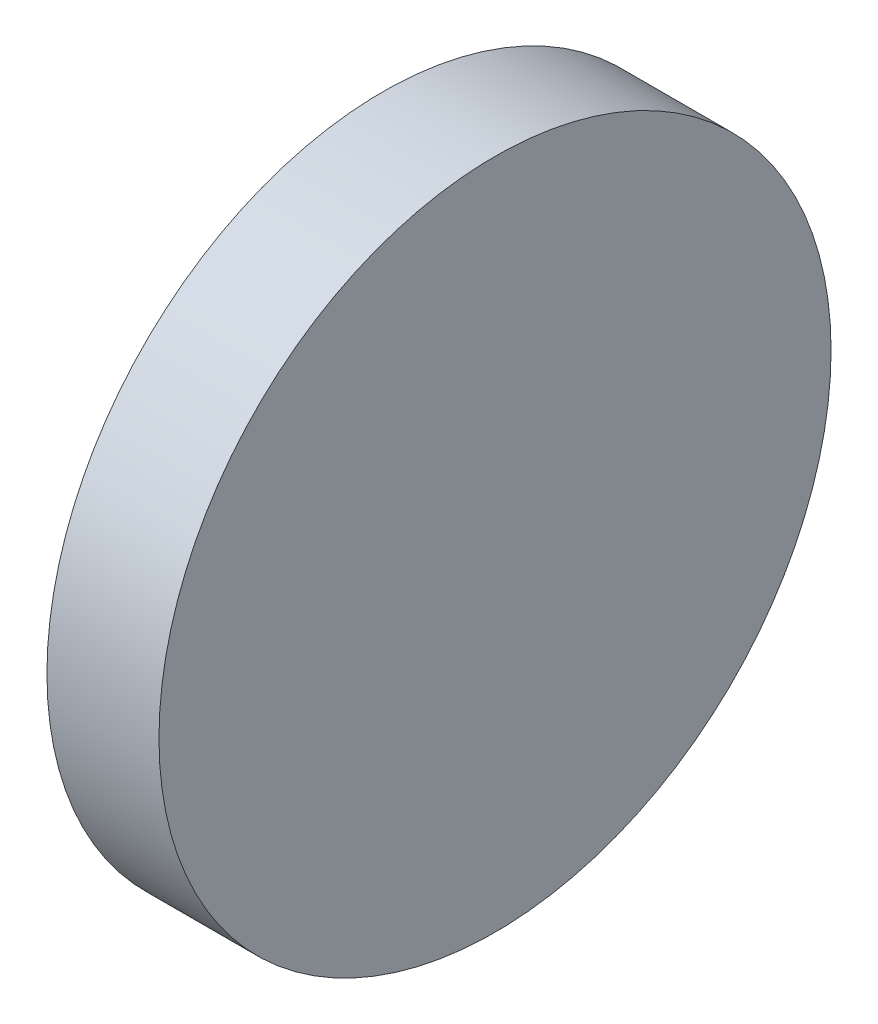
from build123d import *

# Parameters (mm, degrees)
SKETCH1_R           = 38.1
BOSS_EXTRUDE1_DEPTH = 12.7


with BuildPart() as part:
    # Sketch1 → Boss-Extrude1 (new body)
    with BuildSketch(Plane(origin=(0, 0, 0), x_dir=(0, 0, -1), z_dir=(1, 0, 0))):
        Circle(SKETCH1_R)
    extrude(amount=BOSS_EXTRUDE1_DEPTH)


solid = part.part
